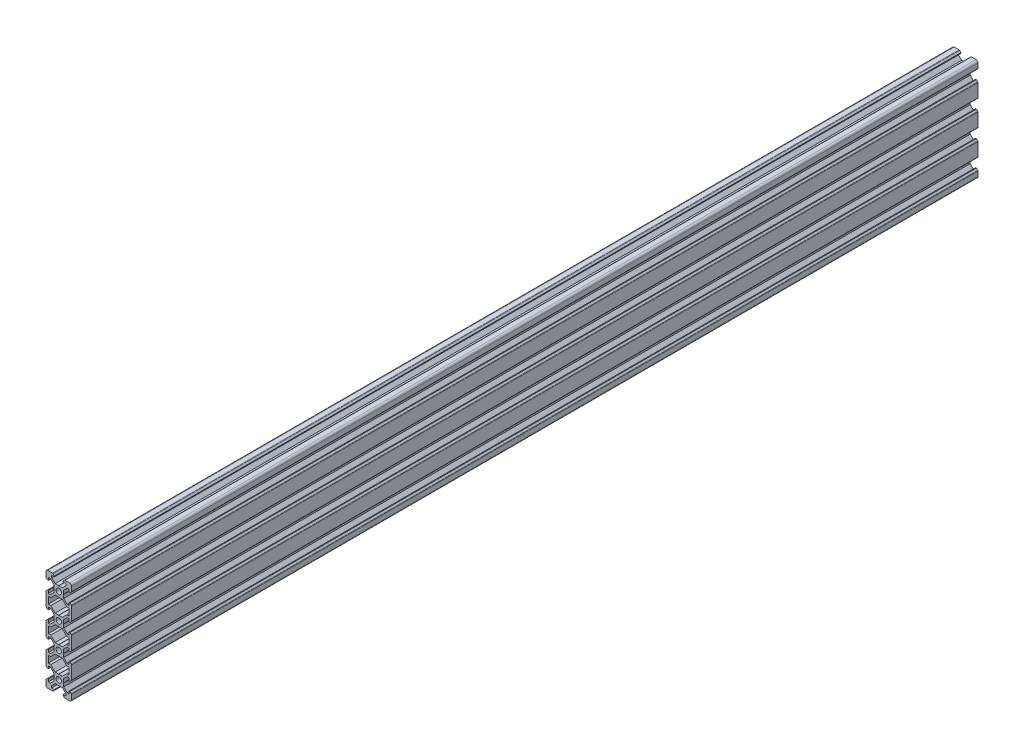
from build123d import *

# Parameters (mm, degrees)
SKETCH1_R           = 2.1
BOSS_EXTRUDE2_DEPTH = 710


with BuildPart() as part:
    # Sketch1 → Boss-Extrude2 (new body)
    with BuildSketch(Plane.XY):
        with BuildLine():
            Line((-8.5, 10), (-4.862792737, 10))
            ThreePointArc((-4.862792737, 10), (-4.598292737, 9.947387679), (-4.374060464, 9.797560464))
            Line((-4.374060464, 9.797560464), (-3.3865, 8.81))
            Line((-3.3865, 8.81), (-3.3865, 8.2))
            Line((-3.3865, 8.2), (-5.5, 8.2))
            Line((-5.5, 8.2), (-5.5, 6.561))
            Line((-5.5, 6.561), (-2.8395, 3.9005))
            Line((-2.8395, 3.9005), (-0.1, 3.9005))
            Line((-0.1, 3.9005), (0, 3.8005))
            Line((0, 3.8005), (0.1, 3.9005))
            Line((0.1, 3.9005), (2.8395, 3.9005))
            Line((2.8395, 3.9005), (5.5, 6.561))
            Line((5.5, 6.561), (5.5, 8.2))
            Line((5.5, 8.2), (3.3865, 8.2))
            Line((3.3865, 8.2), (3.3865, 8.81))
            Line((3.3865, 8.81), (4.374060464, 9.797560464))
            ThreePointArc((4.374060464, 9.797560464), (4.598292737, 9.947387679), (4.862792737, 10))
            Line((4.862792737, 10), (8.5, 10))
            ThreePointArc((8.5, 10), (9.560660172, 9.560660172), (10, 8.5))
            Line((10, 8.5), (10, 4.862792737))
            ThreePointArc((10, 4.862792737), (9.947387679, 4.598292737), (9.797560464, 4.374060464))
            Line((9.797560464, 4.374060464), (8.81, 3.3865))
            Line((8.81, 3.3865), (8.2, 3.3865))
            Line((8.2, 3.3865), (8.2, 5.5))
            Line((8.2, 5.5), (6.561, 5.5))
            Line((6.561, 5.5), (3.9005, 2.8395))
            Line((3.9005, 2.8395), (3.9005, 0.1))
            Line((3.9005, 0.1), (3.8005, 0))
            Line((3.8005, 0), (3.9005, -0.1))
            Line((3.9005, -0.1), (3.9005, -2.8395))
            Line((3.9005, -2.8395), (6.561, -5.5))
            Line((6.561, -5.5), (8.2, -5.5))
            Line((8.2, -5.5), (8.2, -3.3865))
            Line((8.2, -3.3865), (8.81, -3.3865))
            Line((8.81, -3.3865), (9.797560464, -4.374060464))
            ThreePointArc((9.797560464, -4.374060464), (9.947387679, -4.598292737), (10, -4.862792737))
            Line((10, -4.862792737), (10, -15.137207263))
            ThreePointArc((10, -15.137207263), (9.947387679, -15.401707263), (9.797560464, -15.625939536))
            Line((9.797560464, -15.625939536), (8.81, -16.6135))
            Line((8.81, -16.6135), (8.2, -16.6135))
            Line((8.2, -16.6135), (8.2, -14.5))
            Line((8.2, -14.5), (6.561, -14.5))
            Line((6.561, -14.5), (3.9005, -17.1605))
            Line((3.9005, -17.1605), (3.9005, -19.9))
            Line((3.9005, -19.9), (3.8005, -20))
            Line((3.8005, -20), (3.9005, -20.1))
            Line((3.9005, -20.1), (3.9005, -22.8395))
            Line((3.9005, -22.8395), (6.561, -25.5))
            Line((6.561, -25.5), (8.2, -25.5))
            Line((8.2, -25.5), (8.2, -23.3865))
            Line((8.2, -23.3865), (8.81, -23.3865))
            Line((8.81, -23.3865), (9.797560464, -24.374060464))
            ThreePointArc((9.797560464, -24.374060464), (9.947387679, -24.598292737), (10, -24.862792737))
            Line((10, -24.862792737), (10, -35.137207263))
            ThreePointArc((10, -35.137207263), (9.947387679, -35.401707263), (9.797560464, -35.625939536))
            Line((9.797560464, -35.625939536), (8.81, -36.6135))
            Line((8.81, -36.6135), (8.2, -36.6135))
            Line((8.2, -36.6135), (8.2, -34.5))
            Line((8.2, -34.5), (6.561, -34.5))
            Line((6.561, -34.5), (3.9005, -37.1605))
            Line((3.9005, -37.1605), (3.9005, -39.9))
            Line((3.9005, -39.9), (3.8005, -40))
            Line((3.8005, -40), (3.9005, -40.1))
            Line((3.9005, -40.1), (3.9005, -42.8395))
            Line((3.9005, -42.8395), (6.561, -45.5))
            Line((6.561, -45.5), (8.2, -45.5))
            Line((8.2, -45.5), (8.2, -43.3865))
            Line((8.2, -43.3865), (8.81, -43.3865))
            Line((8.81, -43.3865), (9.797560464, -44.374060464))
            ThreePointArc((9.797560464, -44.374060464), (9.947387679, -44.598292737), (10, -44.862792737))
            Line((10, -44.862792737), (10, -55.137207263))
            ThreePointArc((10, -55.137207263), (9.947387679, -55.401707263), (9.797560464, -55.625939536))
            Line((9.797560464, -55.625939536), (8.81, -56.6135))
            Line((8.81, -56.6135), (8.2, -56.6135))
            Line((8.2, -56.6135), (8.2, -54.5))
            Line((8.2, -54.5), (6.561, -54.5))
            Line((6.561, -54.5), (3.9005, -57.1605))
            Line((3.9005, -57.1605), (3.9005, -59.9))
            Line((3.9005, -59.9), (3.8005, -60))
            Line((3.8005, -60), (3.9005, -60.1))
            Line((3.9005, -60.1), (3.9005, -62.8395))
            Line((3.9005, -62.8395), (6.561, -65.5))
            Line((6.561, -65.5), (8.2, -65.5))
            Line((8.2, -65.5), (8.2, -63.3865))
            Line((8.2, -63.3865), (8.81, -63.3865))
            Line((8.81, -63.3865), (9.797560464, -64.374060464))
            ThreePointArc((9.797560464, -64.374060464), (9.947387679, -64.598292737), (10, -64.862792737))
            Line((10, -64.862792737), (10, -68.5))
            ThreePointArc((10, -68.5), (9.560660172, -69.560660172), (8.5, -70))
            Line((8.5, -70), (4.862792737, -70))
            ThreePointArc((4.862792737, -70), (4.598292737, -69.947387679), (4.374060464, -69.797560464))
            Line((4.374060464, -69.797560464), (3.3865, -68.81))
            Line((3.3865, -68.81), (3.3865, -68.2))
            Line((3.3865, -68.2), (5.5, -68.2))
            Line((5.5, -68.2), (5.5, -66.561))
            Line((5.5, -66.561), (2.8395, -63.9005))
            Line((2.8395, -63.9005), (0.1, -63.9005))
            Line((0.1, -63.9005), (0, -63.8005))
            Line((0, -63.8005), (-0.1, -63.9005))
            Line((-0.1, -63.9005), (-2.8395, -63.9005))
            Line((-2.8395, -63.9005), (-5.5, -66.561))
            Line((-5.5, -66.561), (-5.5, -68.2))
            Line((-5.5, -68.2), (-3.3865, -68.2))
            Line((-3.3865, -68.2), (-3.3865, -68.81))
            Line((-3.3865, -68.81), (-4.374060464, -69.797560464))
            ThreePointArc((-4.374060464, -69.797560464), (-4.598292737, -69.947387679), (-4.862792737, -70))
            Line((-4.862792737, -70), (-8.5, -70))
            ThreePointArc((-8.5, -70), (-9.560660172, -69.560660172), (-10, -68.5))
            Line((-10, -68.5), (-10, -64.862792737))
            ThreePointArc((-10, -64.862792737), (-9.947387679, -64.598292737), (-9.797560464, -64.374060464))
            Line((-9.797560464, -64.374060464), (-8.81, -63.3865))
            Line((-8.81, -63.3865), (-8.2, -63.3865))
            Line((-8.2, -63.3865), (-8.2, -65.5))
            Line((-8.2, -65.5), (-6.561, -65.5))
            Line((-6.561, -65.5), (-3.9005, -62.8395))
            Line((-3.9005, -62.8395), (-3.9005, -60.1))
            Line((-3.9005, -60.1), (-3.8005, -60))
            Line((-3.8005, -60), (-3.9005, -59.9))
            Line((-3.9005, -59.9), (-3.9005, -57.1605))
            Line((-3.9005, -57.1605), (-6.561, -54.5))
            Line((-6.561, -54.5), (-8.2, -54.5))
            Line((-8.2, -54.5), (-8.2, -56.6135))
            Line((-8.2, -56.6135), (-8.81, -56.6135))
            Line((-8.81, -56.6135), (-9.797560464, -55.625939536))
            ThreePointArc((-9.797560464, -55.625939536), (-9.947387679, -55.401707263), (-10, -55.137207263))
            Line((-10, -55.137207263), (-10, -44.862792737))
            ThreePointArc((-10, -44.862792737), (-9.947387679, -44.598292737), (-9.797560464, -44.374060464))
            Line((-9.797560464, -44.374060464), (-8.81, -43.3865))
            Line((-8.81, -43.3865), (-8.2, -43.3865))
            Line((-8.2, -43.3865), (-8.2, -45.5))
            Line((-8.2, -45.5), (-6.561, -45.5))
            Line((-6.561, -45.5), (-3.9005, -42.8395))
            Line((-3.9005, -42.8395), (-3.9005, -40.1))
            Line((-3.9005, -40.1), (-3.8005, -40))
            Line((-3.8005, -40), (-3.9005, -39.9))
            Line((-3.9005, -39.9), (-3.9005, -37.1605))
            Line((-3.9005, -37.1605), (-6.561, -34.5))
            Line((-6.561, -34.5), (-8.2, -34.5))
            Line((-8.2, -34.5), (-8.2, -36.6135))
            Line((-8.2, -36.6135), (-8.81, -36.6135))
            Line((-8.81, -36.6135), (-9.797560464, -35.625939536))
            ThreePointArc((-9.797560464, -35.625939536), (-9.947387679, -35.401707263), (-10, -35.137207263))
            Line((-10, -35.137207263), (-10, -24.862792737))
            ThreePointArc((-10, -24.862792737), (-9.947387679, -24.598292737), (-9.797560464, -24.374060464))
            Line((-9.797560464, -24.374060464), (-8.81, -23.3865))
            Line((-8.81, -23.3865), (-8.2, -23.3865))
            Line((-8.2, -23.3865), (-8.2, -25.5))
            Line((-8.2, -25.5), (-6.561, -25.5))
            Line((-6.561, -25.5), (-3.9005, -22.8395))
            Line((-3.9005, -22.8395), (-3.9005, -20.1))
            Line((-3.9005, -20.1), (-3.8005, -20))
            Line((-3.8005, -20), (-3.9005, -19.9))
            Line((-3.9005, -19.9), (-3.9005, -17.1605))
            Line((-3.9005, -17.1605), (-6.561, -14.5))
            Line((-6.561, -14.5), (-8.2, -14.5))
            Line((-8.2, -14.5), (-8.2, -16.6135))
            Line((-8.2, -16.6135), (-8.81, -16.6135))
            Line((-8.81, -16.6135), (-9.797560464, -15.625939536))
            ThreePointArc((-9.797560464, -15.625939536), (-9.947387679, -15.401707263), (-10, -15.137207263))
            Line((-10, -15.137207263), (-10, -4.862792737))
            ThreePointArc((-10, -4.862792737), (-9.947387679, -4.598292737), (-9.797560464, -4.374060464))
            Line((-9.797560464, -4.374060464), (-8.81, -3.3865))
            Line((-8.81, -3.3865), (-8.2, -3.3865))
            Line((-8.2, -3.3865), (-8.2, -5.5))
            Line((-8.2, -5.5), (-6.561, -5.5))
            Line((-6.561, -5.5), (-3.9005, -2.8395))
            Line((-3.9005, -2.8395), (-3.9005, -0.1))
            Line((-3.9005, -0.1), (-3.8005, 0))
            Line((-3.8005, 0), (-3.9005, 0.1))
            Line((-3.9005, 0.1), (-3.9005, 2.8395))
            Line((-3.9005, 2.8395), (-6.561, 5.5))
            Line((-6.561, 5.5), (-8.2, 5.5))
            Line((-8.2, 5.5), (-8.2, 3.3865))
            Line((-8.2, 3.3865), (-8.81, 3.3865))
            Line((-8.81, 3.3865), (-9.797560464, 4.374060464))
            ThreePointArc((-9.797560464, 4.374060464), (-9.947387679, 4.598292737), (-10, 4.862792737))
            Line((-10, 4.862792737), (-10, 8.5))
            ThreePointArc((-10, 8.5), (-9.560660172, 9.560660172), (-8.5, 10))
        make_face()
        Circle(SKETCH1_R, mode=Mode.SUBTRACT)
        with Locations((0, -20)):
            Circle(SKETCH1_R, mode=Mode.SUBTRACT)
        with Locations((0, -40)):
            Circle(SKETCH1_R, mode=Mode.SUBTRACT)
        with Locations((0, -60)):
            Circle(SKETCH1_R, mode=Mode.SUBTRACT)
        Polygon((-2.8395, -23.9005), (-0.1, -23.9005), (0, -23.8005), (0.1, -23.9005), (2.8395, -23.9005), (5.5, -26.561), (6.239, -27.3), (8.2, -27.3), (8.2, -32.7), (6.239, -32.7), (5.5, -33.439), (2.8395, -36.0995), (0.1, -36.0995), (0, -36.1995), (-0.1, -36.0995), (-2.8395, -36.0995), (-5.5, -33.439), (-6.239, -32.7), (-8.2, -32.7), (-8.2, -27.3), (-6.239, -27.3), (-5.5, -26.561), align=None, mode=Mode.SUBTRACT)
        Polygon((-8.2, -12.7), (-8.2, -7.3), (-6.239, -7.3), (-5.5, -6.561), (-2.8395, -3.9005), (-0.1, -3.9005), (0, -3.8005), (0.1, -3.9005), (2.8395, -3.9005), (5.5, -6.561), (6.239, -7.3), (8.2, -7.3), (8.2, -12.7), (6.239, -12.7), (5.5, -13.439), (2.8395, -16.0995), (0.1, -16.0995), (0, -16.1995), (-0.1, -16.0995), (-2.8395, -16.0995), (-5.5, -13.439), (-6.239, -12.7), align=None, mode=Mode.SUBTRACT)
        Polygon((-2.8395, -43.9005), (-0.1, -43.9005), (0, -43.8005), (0.1, -43.9005), (2.8395, -43.9005), (5.5, -46.561), (6.239, -47.3), (8.2, -47.3), (8.2, -52.7), (6.239, -52.7), (5.5, -53.439), (2.8395, -56.0995), (0.1, -56.0995), (0, -56.1995), (-0.1, -56.0995), (-2.8395, -56.0995), (-5.5, -53.439), (-6.239, -52.7), (-8.2, -52.7), (-8.2, -47.3), (-6.239, -47.3), (-5.5, -46.561), align=None, mode=Mode.SUBTRACT)
    extrude(amount=BOSS_EXTRUDE2_DEPTH)


solid = part.part
